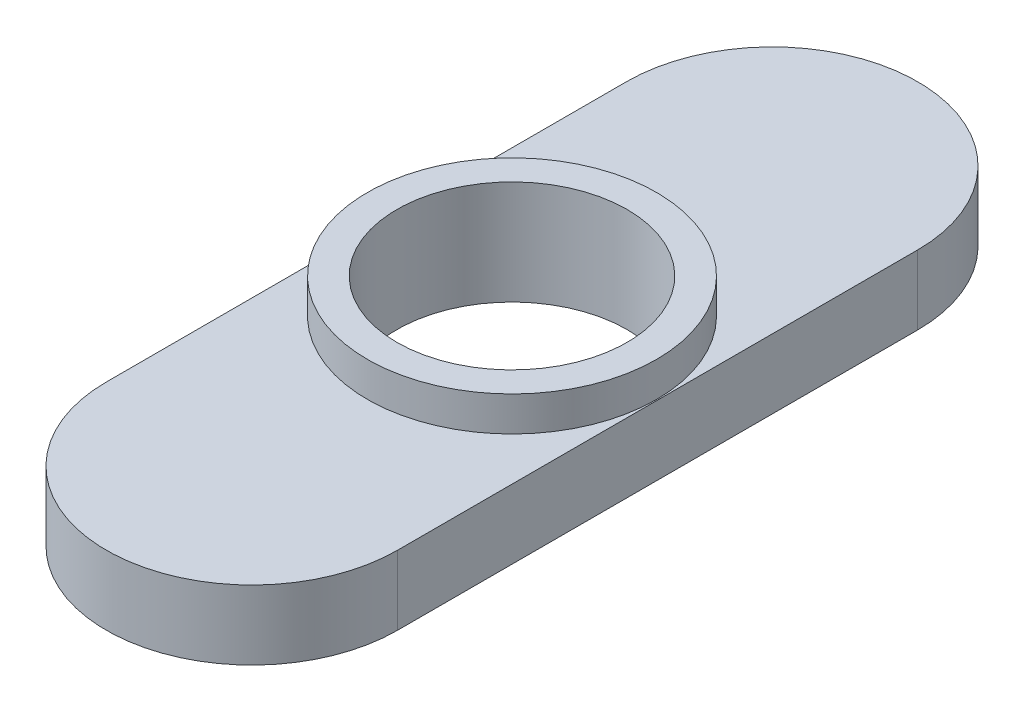
from build123d import *

# Parameters (mm, degrees)
BOSS_EXTRUDE1_DEPTH = 2.54
SKETCH2_R           = 4.2164
CUT_EXTRUDE1_DEPTH  = 2.54
EXTRUDE_THIN1_START = 1.27
SKETCH3_R           = 5.2959
SKETCH3_R_2         = 4.2164
EXTRUDE_THIN1_DEPTH = 1.27


with BuildPart() as part:
    # Sketch1 → Boss-Extrude1 (new body)
    with BuildSketch(Plane(origin=(0, 0, 0), x_dir=(1, 0, 0), z_dir=(0, 1, 0))):
        with BuildLine():
            Line((5.334, 9.525), (5.334, -9.525))
            ThreePointArc((5.334, -9.525), (0, -14.859), (-5.334, -9.525))
            Line((-5.334, -9.525), (-5.334, 9.525))
            ThreePointArc((-5.334, 9.525), (0, 14.859), (5.334, 9.525))
        make_face()
    extrude(amount=BOSS_EXTRUDE1_DEPTH)

    # Sketch2 → Cut-Extrude1 (cut)
    with BuildSketch(Plane(origin=(0, 2.54, 0), x_dir=(1, 0, 0), z_dir=(0, 1, 0))):
        with Locations(Location((0, 0, 0), (0, 0, 270))):
            Circle(SKETCH2_R)
    extrude(amount=-CUT_EXTRUDE1_DEPTH, mode=Mode.SUBTRACT)

    # Sketch3 → Extrude-Thin1 (add)
    with BuildSketch(Plane(origin=(0, 2.54, 0), x_dir=(1, 0, 0), z_dir=(0, 1, 0)).offset(EXTRUDE_THIN1_START)):
        Circle(SKETCH3_R)
        Circle(SKETCH3_R_2, mode=Mode.SUBTRACT)
    extrude(amount=-EXTRUDE_THIN1_DEPTH)


solid = part.part
